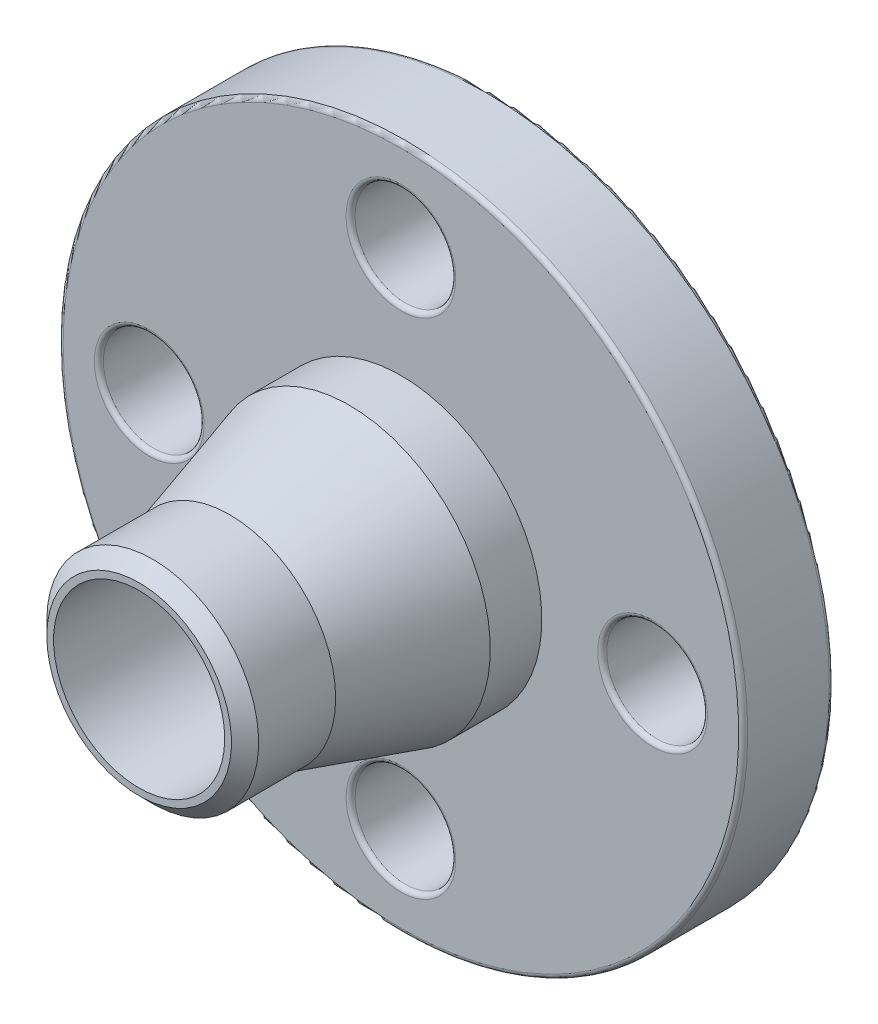
from build123d import *

# Parameters (mm, degrees)
SKETCH3_R          = 7.9375
CUT_EXTRUDE1_DEPTH = 87.776879841
CIRPATTERN1_COUNT  = 4
FILLET1_R          = 2.8575
CHAMFER1_SIZE      = 2.143125
FILLET2_R          = 0.714375
SKETCH4_R          = 68.892595573
SKETCH4_R_2        = 22.225
CUT_EXTRUDE2_DEPTH = 41.275
CUT_EXTRUDE3_START = -6.35
SKETCH5_R          = 22.225
CUT_EXTRUDE3_DEPTH = 6.35


with BuildPart() as part:
    # Sketch2 → Revolve1 (revolve)
    with BuildSketch(Plane(origin=(0, 0, 0), x_dir=(0, 0, -1), z_dir=(1, 0, 0)), mode=Mode.PRIVATE) as revolve1_sk:
        Polygon((-27.78125, 16.7005), (-27.78125, 13.49375), (27.78125, 13.49375), (27.78125, 53.975), (13.49375, 53.975), (13.49375, 24.60625), (-13.49375, 16.7005), align=None)
    revolve(revolve1_sk.sketch.rotate(Axis((0, 0, 27.78125), (0, 0, -1)), 90), axis=Axis((0, 0, 27.78125), (0, 0, -1)))

    # Sketch3 → Cut-Extrude1 (cut, through all)
    with BuildSketch(Plane.XY.offset(-13.49375)):
        with Locations((0, 39.6875)):
            Circle(SKETCH3_R)
    cut_extrude1 = extrude(amount=-CUT_EXTRUDE1_DEPTH, mode=Mode.SUBTRACT)

    # CirPattern1: Cut-Extrude1 ×4 about axis
    cirpattern1_axis = Axis((0, 0, 0), (0, 0, 1))
    for i in range(1, CIRPATTERN1_COUNT):
        add(cut_extrude1.rotate(cirpattern1_axis, i * 360 / CIRPATTERN1_COUNT), mode=Mode.SUBTRACT)

    # Fillet1
    fillet1_edges = [part.edges().sort_by_distance(p)[0] for p in [
        (-24.60625, 0, -13.49375),
    ]]
    fillet(fillet1_edges, radius=FILLET1_R)

    # Chamfer1
    chamfer1_edges = [part.edges().sort_by_distance(p)[0] for p in [
        (-16.7005, 0, 27.78125),
    ]]
    chamfer(chamfer1_edges, length=CHAMFER1_SIZE)

    # Fillet2
    fillet2_edges = [part.edges().sort_by_distance(p)[0] for p in [
        (-7.9375, 39.6875, -27.78125),
        (-7.9375, 39.6875, -13.49375),
        (39.6875, 7.9375, -27.78125),
        (39.6875, 7.9375, -13.49375),
        (7.9375, -39.6875, -27.78125),
        (7.9375, -39.6875, -13.49375),
        (-39.6875, -7.9375, -27.78125),
        (-39.6875, -7.9375, -13.49375),
        (-53.975, 0, -13.49375),
        (-53.975, 0, -27.78125),
        (-13.49375, 0, -27.78125),
    ]]
    fillet(fillet2_edges, radius=FILLET2_R)

    # Sketch4 → Cut-Extrude2 (cut)
    with BuildSketch(Plane.XY.offset(27.78125)):
        Circle(SKETCH4_R)
        with Locations(Location((0, 0, 0), (0, 0, 180))):
            Circle(SKETCH4_R_2, mode=Mode.SUBTRACT)
    extrude(amount=-CUT_EXTRUDE2_DEPTH, mode=Mode.SUBTRACT)

    # Sketch5 → Cut-Extrude3 (cut)
    with BuildSketch(Plane(origin=(0, 0, -27.78125), x_dir=(-1, 0, 0), z_dir=(0, 0, -1)).offset(CUT_EXTRUDE3_START)):
        Circle(SKETCH5_R)
    extrude(amount=CUT_EXTRUDE3_DEPTH, mode=Mode.SUBTRACT)


solid = part.part
